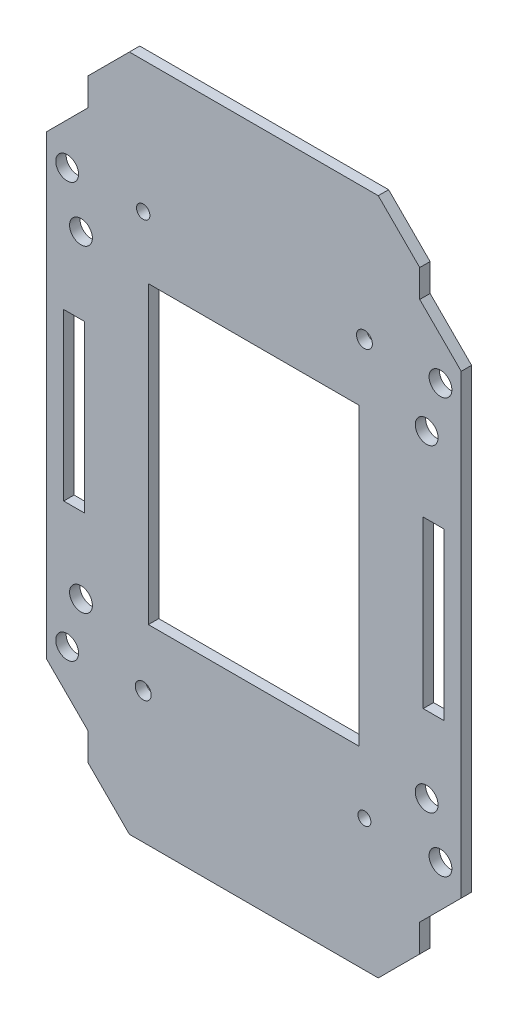
from build123d import *

# Parameters (mm, degrees)
SKETCH_1_R            = 1.15
SKETCH_1_R_2          = 0.939967297
SKETCH_1_R_3          = 0.967686678
SKETCH_1_R_4          = 1.65
SKETCH_1_W            = 30.4982
SKETCH_1_H            = 42.7098
SKETCH_1_W_2          = 3
SKETCH_1_H_2          = 24
PIXHAWK_M3_DEPTH      = 1.5
SKETCH_2_R            = 1.65
CUT_EXTRUDE_515_DEPTH = 1.5


with BuildPart() as part:
    # 草图1 → Pixhawk正装减振托板_绑带槽_四M3孔 (new body)
    with BuildSketch(Plane.XY):
        Polygon((24, -39), (24, -43), (18, -49), (-18, -49), (-24, -43), (-24, -39), (-30, -33), (-30, 33), (-24, 39), (-24, 43), (-18, 49), (18, 49), (24, 43), (24, 39), (30, 33), (30, -33), align=None)
        with Locations((16, 30)):
            Circle(SKETCH_1_R, mode=Mode.SUBTRACT)
        with Locations((-16, -30)):
            Circle(SKETCH_1_R, mode=Mode.SUBTRACT)
        with Locations((16, -30)):
            Circle(SKETCH_1_R_2, mode=Mode.SUBTRACT)
        with Locations((-16, 30)):
            Circle(SKETCH_1_R_3, mode=Mode.SUBTRACT)
        with Locations((-27, -30)):
            Circle(SKETCH_1_R_4, mode=Mode.SUBTRACT)
        with Locations((-27, 30)):
            Circle(SKETCH_1_R_4, mode=Mode.SUBTRACT)
        with Locations((27, -30)):
            Circle(SKETCH_1_R_4, mode=Mode.SUBTRACT)
        with Locations((27, 30)):
            Circle(SKETCH_1_R_4, mode=Mode.SUBTRACT)
        Rectangle(SKETCH_1_W, SKETCH_1_H, mode=Mode.SUBTRACT)
        with Locations((-26, 0)):
            Rectangle(SKETCH_1_W_2, SKETCH_1_H_2, mode=Mode.SUBTRACT)
        with Locations((26, 0)):
            Rectangle(SKETCH_1_W_2, SKETCH_1_H_2, mode=Mode.SUBTRACT)
    extrude(amount=PIXHAWK_M3_DEPTH)

    # 草图2 → Cut-Extrude 515 (cut)
    with BuildSketch(Plane.XY):
        with Locations((-25, -23)):
            Circle(SKETCH_2_R)
        with Locations((-25, 23)):
            Circle(SKETCH_2_R)
        with Locations((25, -23)):
            Circle(SKETCH_2_R)
        with Locations((25, 23)):
            Circle(SKETCH_2_R)
    extrude(amount=CUT_EXTRUDE_515_DEPTH, mode=Mode.SUBTRACT)


solid = part.part
